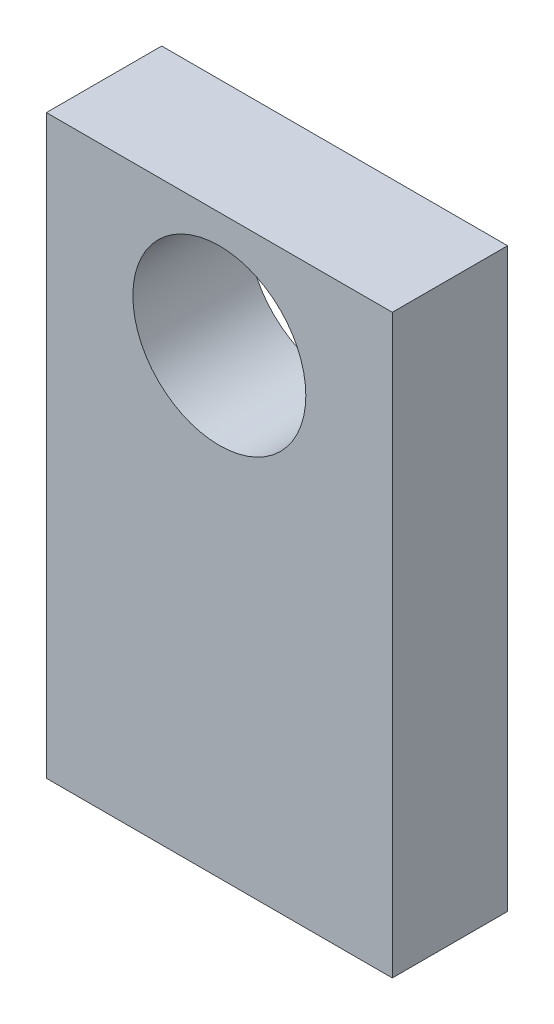
from build123d import *

# Parameters (mm, degrees)
SKETCH1_W           = 30
SKETCH1_H           = 50
SKETCH1_R           = 7.5
BOSS_EXTRUDE1_DEPTH = 10


with BuildPart() as part:
    # Sketch1 → Boss-Extrude1 (new body)
    with BuildSketch(Plane.XY):
        Rectangle(SKETCH1_W, SKETCH1_H)
        with Locations((0, 15)):
            Circle(SKETCH1_R, mode=Mode.SUBTRACT)
    extrude(amount=BOSS_EXTRUDE1_DEPTH)


solid = part.part
